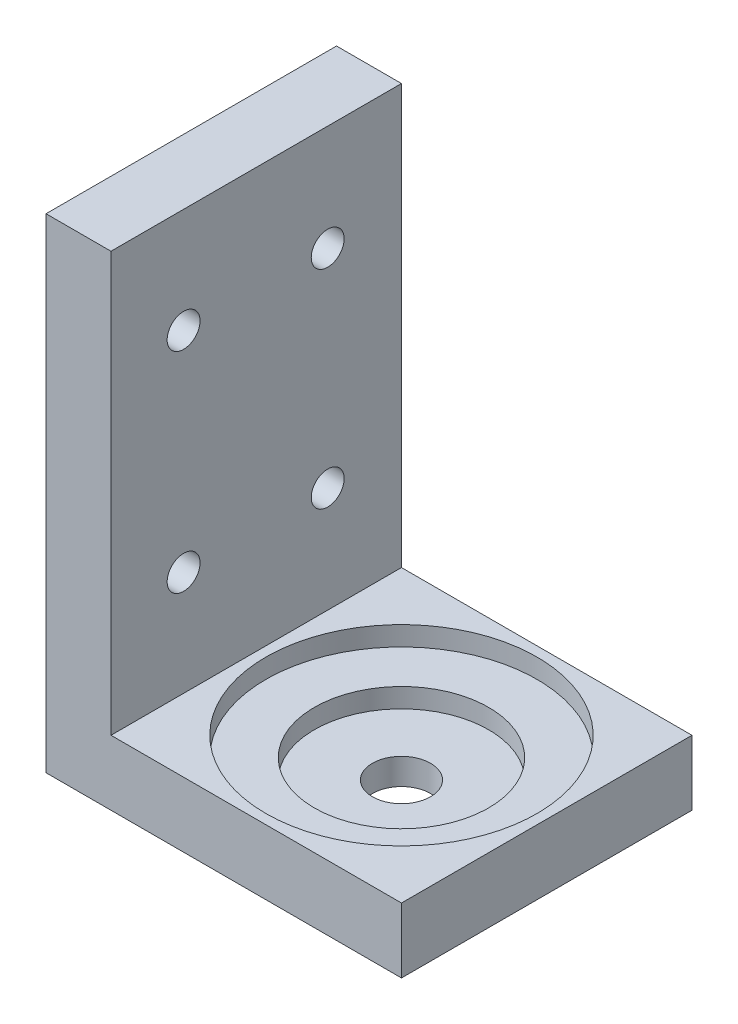
from build123d import *

# Parameters (mm, degrees)
SKETCH2_W           = 30
SKETCH2_H           = 30
BOSS_EXTRUDE1_DEPTH = 6.708
SKETCH5_R           = 14
CUT_EXTRUDE1_DEPTH  = 2
SKETCH13_R          = 9
CUT_EXTRUDE3_DEPTH  = 2
SKETCH15_R          = 3
CUT_EXTRUDE5_DEPTH  = 8.35
SKETCH16_W          = 6.708000046
SKETCH16_H          = 50
BOSS_EXTRUDE3_DEPTH = 30
SKETCH17_R          = 1.7
CUT_EXTRUDE7_DEPTH  = 6.708


with BuildPart() as part:
    # Sketch2 → Boss-Extrude1 (new body)
    with BuildSketch(Plane(origin=(0, 0, 0), x_dir=(1, 0, 0), z_dir=(0, 1, 0))):
        with Locations((-146.375821197, 89.110918047)):
            Rectangle(SKETCH2_W, SKETCH2_H)
    extrude(amount=BOSS_EXTRUDE1_DEPTH)

    # Sketch5 → Cut-Extrude1 (cut)
    with BuildSketch(Plane(origin=(0, 6.708, 0), x_dir=(1, 0, 0), z_dir=(0, 1, 0))):
        with Locations(Location((-146.375821197, 89.110918047, 0), (0, 0, 270))):
            Circle(SKETCH5_R)
    extrude(amount=-CUT_EXTRUDE1_DEPTH, mode=Mode.SUBTRACT)

    # Sketch13 → Cut-Extrude3 (cut)
    with BuildSketch(Plane(origin=(0, 4.708, 0), x_dir=(1, 0, 0), z_dir=(0, 1, 0))):
        with Locations(Location((-146.375821197, 89.110918047, 0), (0, 0, 270))):
            Circle(SKETCH13_R)
    extrude(amount=-CUT_EXTRUDE3_DEPTH, mode=Mode.SUBTRACT)

    # Sketch15 → Cut-Extrude5 (cut)
    with BuildSketch(Plane(origin=(0, 2.708, 0), x_dir=(1, 0, 0), z_dir=(0, 1, 0))):
        with Locations(Location((-146.375821197, 89.110918047, 0), (0, 0, 270))):
            Circle(SKETCH15_R)
    extrude(amount=-CUT_EXTRUDE5_DEPTH, mode=Mode.SUBTRACT)

    # Sketch16 → Boss-Extrude3 (add)
    with BuildSketch(Plane.XY.offset(-74.110918047)):
        with Locations((-164.72982122, 25)):
            Rectangle(SKETCH16_W, SKETCH16_H)
    extrude(amount=-BOSS_EXTRUDE3_DEPTH)

    # Sketch17 → Cut-Extrude7 (cut)
    with BuildSketch(Plane(origin=(-161.375821197, 0, 0), x_dir=(0, 0, -1), z_dir=(1, 0, 0))):
        with Locations((81.610918047, 17.533)):
            Circle(SKETCH17_R)
        with Locations((96.490918047, 17.63)):
            Circle(SKETCH17_R)
        with Locations(Location((96.490918047, 39.078, 0), (0, 0, 180))):
            Circle(SKETCH17_R)
        with Locations(Location((81.610918047, 39.175, 0), (0, 0, 180))):
            Circle(SKETCH17_R)
    extrude(amount=-CUT_EXTRUDE7_DEPTH, mode=Mode.SUBTRACT)


solid = part.part
